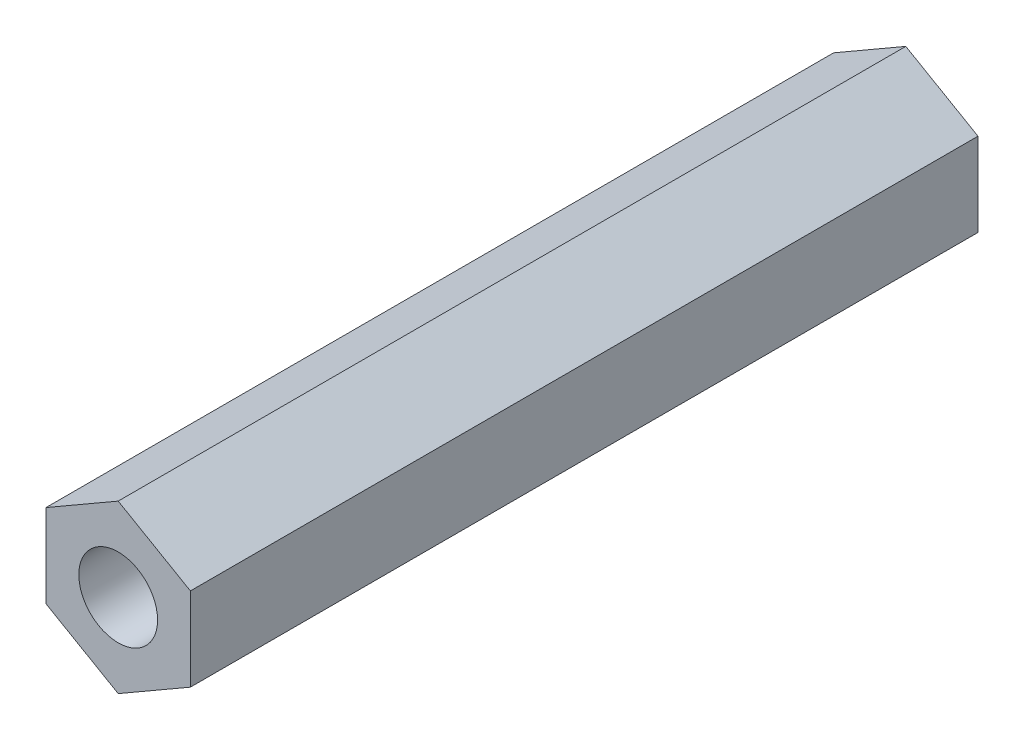
from build123d import *

# Parameters (mm, degrees)
ESQUISSE1_R        = 1.5
BOSS_EXTRU_1_DEPTH = 30


with BuildPart() as part:
    # Esquisse1 → Boss.-Extru.1 (new body)
    with BuildSketch(Plane.XY):
        Polygon((0, -3.175426481), (2.75, -1.58771324), (2.75, 1.58771324), (0, 3.175426481), (-2.75, 1.58771324), (-2.75, -1.58771324), align=None)
        Circle(ESQUISSE1_R, mode=Mode.SUBTRACT)
    extrude(amount=BOSS_EXTRU_1_DEPTH)


solid = part.part
